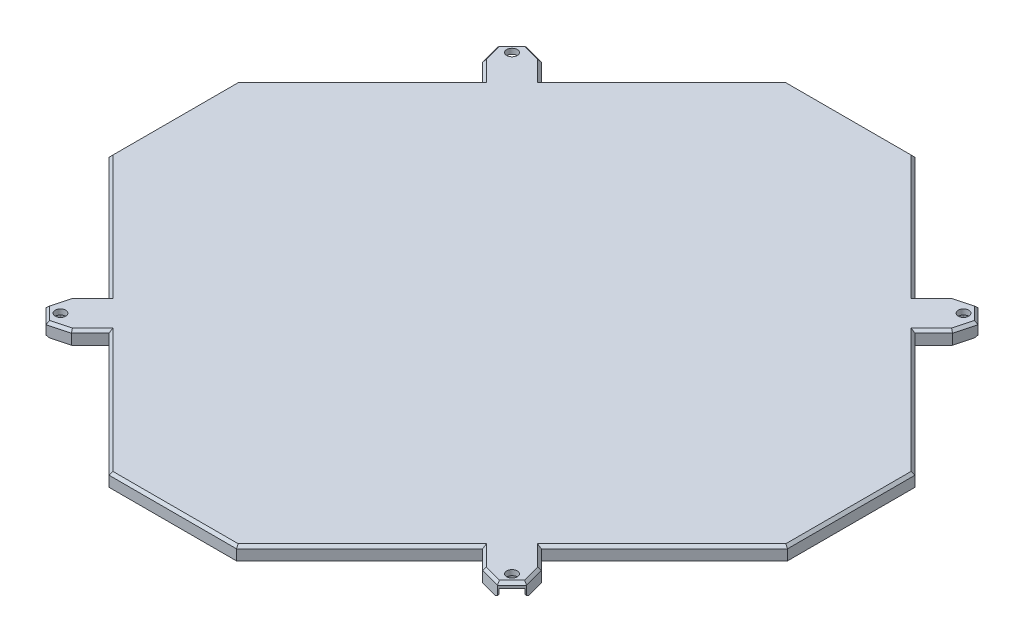
from build123d import *

# Parameters (mm, degrees)
SKETCH2_R                            = 2
SKETCH2_R_2                          = 1.999999996
MAIN_FLOOR_EXTRUDE_DEPTH             = 5
MAIN_FLOOR_CHAMFER_SIZE              = 1
MOUNT_SCREW_COUNTERSINK_DEPTH        = 3
MOUNT_SCREW_COUNTERSINK_CHAMFER_SIZE = 1


with BuildPart() as part:
    # Sketch2 → Main Floor Extrude (new body)
    with BuildSketch(Plane(origin=(0, 0, 0), x_dir=(1, 0, 0), z_dir=(0, 1, 0))):
        Polygon((129.222330464, 0), (129.222330464, -24.28090912), (82.337763357, -71.165476227), (89.511362957, -78.339075827), (91.560037368, -85.984832777), (85.984832777, -91.560037368), (78.339075822, -89.511362977), (71.165476214, -82.33776337), (24.280909108, -129.222330477), (0, -129.222330477), (-24.28090912, -129.222330477), (-71.165476227, -82.33776337), (-78.339075827, -89.51136297), (-85.984832777, -91.560037381), (-91.560037368, -85.984832789), (-89.511362977, -78.339075834), (-82.33776337, -71.165476227), (-129.222330477, -24.28090912), (-129.222330477, -1.3e-08), (-129.222330477, 24.280909108), (-82.33776337, 71.165476214), (-89.51136297, 78.339075814), (-91.560037381, 85.984832764), (-85.984832789, 91.560037355), (-78.339075834, 89.511362964), (-71.165476227, 82.337763357), (-24.28090912, 129.222330464), (-1.3e-08, 129.222330464), (24.280909108, 129.222330464), (71.165476214, 82.337763357), (78.339075814, 89.511362957), (85.984832764, 91.560037368), (91.560037355, 85.984832777), (89.511362964, 78.339075822), (82.337763357, 71.165476214), (129.222330464, 24.280909108), align=None)
        with Locations(Location((86.014718626, -86.014718626, 0), (0, 0, 270))):
            Circle(SKETCH2_R, mode=Mode.SUBTRACT)
        with Locations(Location((-86.014718626, -86.014718639, 0), (0, 0, 270))):
            Circle(SKETCH2_R, mode=Mode.SUBTRACT)
        with Locations(Location((-86.014718639, 86.014718613, 0), (0, 0, 270))):
            Circle(SKETCH2_R, mode=Mode.SUBTRACT)
        with Locations(Location((86.014718613, 86.014718626, 0), (0, 0, 270))):
            Circle(SKETCH2_R_2, mode=Mode.SUBTRACT)
    extrude(amount=MAIN_FLOOR_EXTRUDE_DEPTH)

    # Main Floor Chamfer
    main_floor_chamfer_edges = [part.edges().sort_by_distance(p)[0] for p in [
        (-74.752276027, 5, 85.92456317),
        (-47.723192674, 5, 105.780046923),
        (-6e-09, 5, 129.222330477),
        (47.723192661, 5, 105.780046923),
        (74.752276018, 5, 85.924563174),
        (82.161954299, 5, 90.535700173),
        (88.772435072, 5, 88.772435072),
        (85.924563161, 5, -74.752276018),
        (90.535700163, 5, 82.161954302),
        (85.924563157, 5, 74.752276027),
        (105.780046911, 5, 47.723192674),
        (90.53570016, 5, -82.161954299),
        (88.77243506, 5, -88.772435072),
        (82.161954289, 5, -90.535700163),
        (74.752276014, 5, -85.924563157),
        (47.723192661, 5, -105.780046911),
        (-6e-09, 5, -129.222330464),
        (-47.723192674, 5, -105.780046911),
        (-74.752276031, 5, -85.924563161),
        (129.222330464, 5, 6e-09),
        (-82.161954312, 5, -90.53570016),
        (-88.772435085, 5, -88.77243506),
        (-90.535700175, 5, -82.161954289),
        (-85.92456317, 5, -74.752276014),
        (-105.780046923, 5, -47.723192661),
        (-129.222330477, 5, 6e-09),
        (-105.780046923, 5, 47.723192674),
        (-85.924563174, 5, 74.752276031),
        (-90.535700173, 5, 82.161954312),
        (105.780046911, 5, -47.723192661),
        (-88.772435072, 5, 88.772435085),
        (-82.161954302, 5, 90.535700175),
    ]]
    chamfer(main_floor_chamfer_edges, length=MAIN_FLOOR_CHAMFER_SIZE)

    # Sketch3 → Mount Screw Countersink (cut)
    with BuildSketch(Plane(origin=(0, 0, 0), x_dir=(-1, 0, 0), z_dir=(0, -1, 0))):
        with BuildLine():
            Line((91.247308807, -86.297561351), (88.48959236, -83.539844904))
            ThreePointArc((88.48959236, -83.539844904), (83.539844892, -83.539844904), (83.539844892, -88.489592373))
            Line((83.539844892, -88.489592373), (86.297561338, -91.247308819))
            Line((86.297561338, -91.247308819), (91.247308807, -86.297561351))
        make_face()
        with BuildLine():
            Line((-86.297561351, -91.247308807), (-83.539844904, -88.48959236))
            ThreePointArc((-83.539844904, -88.48959236), (-83.539844904, -83.539844892), (-88.489592373, -83.539844892))
            Line((-88.489592373, -83.539844892), (-91.247308819, -86.297561338))
            Line((-91.247308819, -86.297561338), (-86.297561351, -91.247308807))
        make_face()
        with BuildLine():
            Line((-91.247308807, 86.297561351), (-88.48959236, 83.539844904))
            ThreePointArc((-88.48959236, 83.539844904), (-83.539844892, 83.539844904), (-83.539844892, 88.489592373))
            Line((-83.539844892, 88.489592373), (-86.297561338, 91.247308819))
            Line((-86.297561338, 91.247308819), (-91.247308807, 86.297561351))
        make_face()
        with BuildLine():
            Line((86.297561351, 91.247308807), (83.539844904, 88.48959236))
            ThreePointArc((83.539844904, 88.48959236), (83.539844904, 83.539844892), (88.489592373, 83.539844892))
            Line((88.489592373, 83.539844892), (91.247308819, 86.297561338))
            Line((91.247308819, 86.297561338), (86.297561351, 91.247308807))
        make_face()
    extrude(amount=-MOUNT_SCREW_COUNTERSINK_DEPTH, mode=Mode.SUBTRACT)

    # Mount Screw Countersink Chamfer
    mount_screw_countersink_chamfer_edges = [part.edges().sort_by_distance(p)[0] for p in [
        (-84.918703128, 0, -89.868450583),
        (-89.868450596, 0, -84.918703115),
        (-83.539844904, 0, -83.539844892),
        (89.868450583, 0, -84.918703128),
        (84.918703115, 0, -89.868450596),
        (83.539844892, 0, -83.539844904),
        (84.918703128, 0, 89.868450583),
        (89.868450596, 0, 84.918703115),
        (83.539844904, 0, 83.539844892),
        (-89.868450583, 0, 84.918703128),
        (-84.918703115, 0, 89.868450596),
        (-83.539844892, 0, 83.539844904),
    ]]
    chamfer(mount_screw_countersink_chamfer_edges, length=MOUNT_SCREW_COUNTERSINK_CHAMFER_SIZE)


solid = part.part
